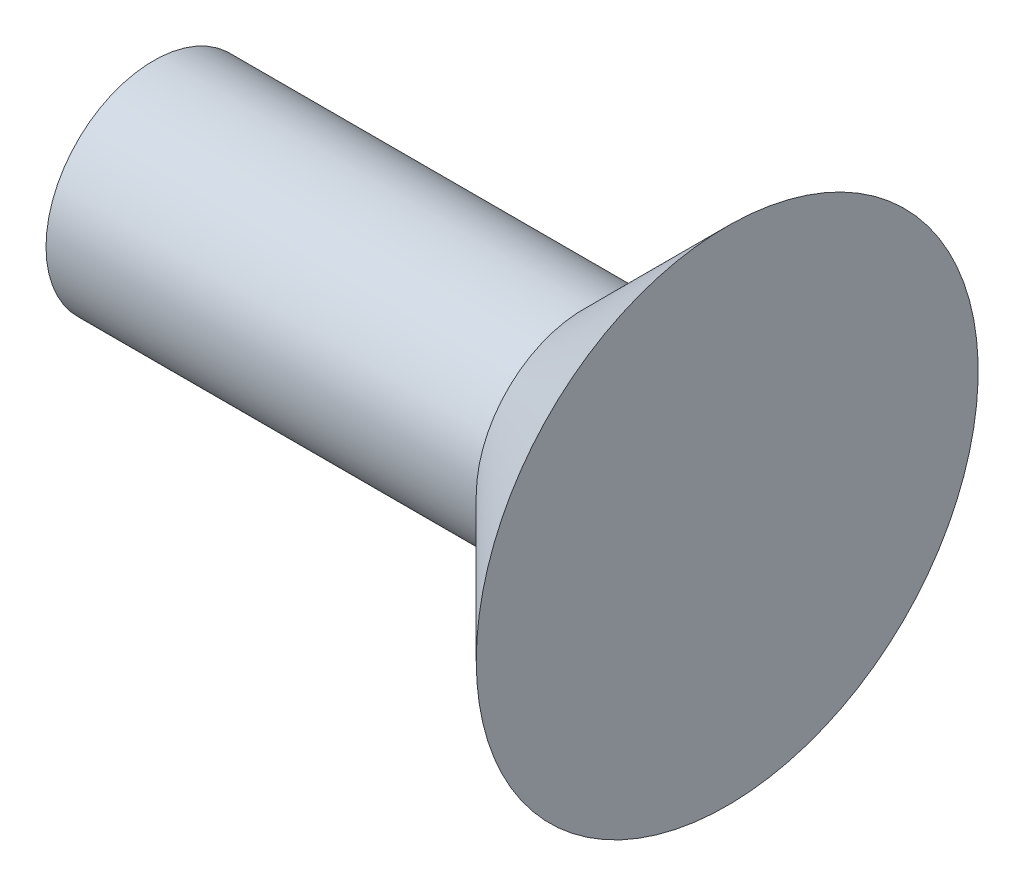
from build123d import *

# Parameters (mm, degrees)
CUT_EXTRUDE1_DEPTH = 6


with BuildPart() as part:
    # Sketch1 → Revolve2 (revolve)
    with BuildSketch(Plane.XY, mode=Mode.PRIVATE) as revolve2_sk:
        Polygon((-84.003233386, 19.234385214), (-72.003233386, 19.234385214), (-70.003233386, 21.234385214), (-70.003233386, 17.734385214), (-84.003233386, 17.734385214), align=None)
    revolve(revolve2_sk.sketch.rotate(Axis((-84.003233386, 17.734385214, 0), (1, 0, 0)), 90), axis=Axis((-84.003233386, 17.734385214, 0), (1, 0, 0)))

    # Sketch2 → Cut-Extrude1 (cut)
    with BuildSketch(Plane.ZY.offset(84.003233386)):
        Polygon((-1.961093313, 19.648785829), (-2.08116025, 15.940051537), (2.199763695, 15.801460474), (2.094501021, 19.742171225), align=None)
    extrude(amount=-CUT_EXTRUDE1_DEPTH, mode=Mode.SUBTRACT)


solid = part.part
